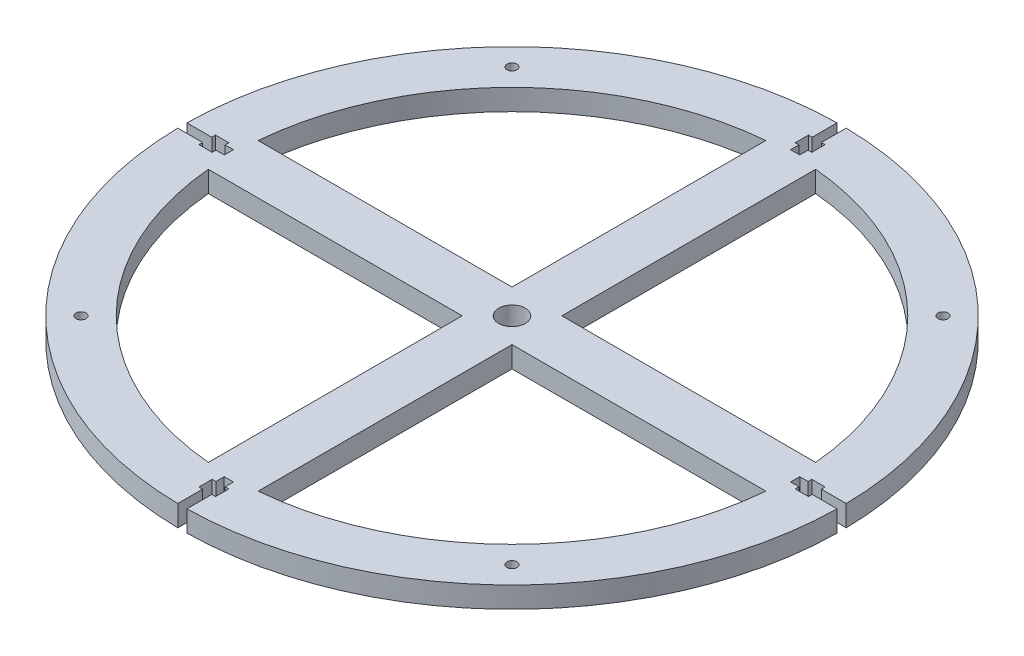
from build123d import *

# Parameters (mm, degrees)
SKETCH1_W                    = 15
SKETCH1_H                    = 15
BOSS_EXTRUDE1_DEPTH          = 3.175
SKETCH2_W                    = 2.75
SKETCH2_H                    = 2.5
SKETCH2_H_2                  = 4
SKETCH2_W_2                  = 1.125
SKETCH2_H_3                  = 7.5
CUT_EXTRUDE1_DEPTH           = 141.379634965
CIRPATTERN1_COUNT            = 4
F_3_0_3_DIAMETER_HOLE1_D     = 3
F_8_0_8_DIAMETER_HOLE1_D     = 8
F_8_0_8_DIAMETER_HOLE1_DEPTH = 6.35


with BuildPart() as part:
    # Sketch1 → Boss-Extrude1 (new, symmetric)
    with BuildSketch(Plane(origin=(0, 0, 0), x_dir=(1, 0, 0), z_dir=(0, 1, 0))):
        with BuildLine():
            Line((-83.903460262, -7.5), (-98.95418457, -7.5))
            ThreePointArc((-98.95418457, -7.5), (-70.171862751, -70.171862751), (-7.5, -98.95418457))
            Line((-7.5, -98.95418457), (-7.5, -83.903460262))
            ThreePointArc((-7.5, -83.903460262), (-59.565261034, -59.565261034), (-83.903460262, -7.5))
        make_face()
        with BuildLine():
            ThreePointArc((-98.95418457, 7.5), (-99.238, 0), (-98.95418457, -7.5))
            Line((-98.95418457, -7.5), (-83.903460262, -7.5))
            ThreePointArc((-83.903460262, -7.5), (-84.238, 0), (-83.903460262, 7.5))
            Line((-83.903460262, 7.5), (-98.95418457, 7.5))
        make_face()
        with BuildLine():
            Line((83.903460262, -7.5), (98.95418457, -7.5))
            ThreePointArc((98.95418457, -7.5), (99.167020759, -3.752684079), (99.238, 0))
            ThreePointArc((99.238, 0), (99.167020759, 3.752684079), (98.95418457, 7.5))
            Line((98.95418457, 7.5), (83.903460262, 7.5))
            ThreePointArc((83.903460262, 7.5), (84.154323506, 3.753728707), (84.238, 0))
            ThreePointArc((84.238, 0), (84.154323506, -3.753728707), (83.903460262, -7.5))
        make_face()
        with BuildLine():
            ThreePointArc((-7.5, 98.95418457), (-70.171862751, 70.171862751), (-98.95418457, 7.5))
            Line((-98.95418457, 7.5), (-83.903460262, 7.5))
            ThreePointArc((-83.903460262, 7.5), (-59.565261034, 59.565261034), (-7.5, 83.903460262))
            Line((-7.5, 83.903460262), (-7.5, 98.95418457))
        make_face()
        with BuildLine():
            Line((-7.5, -83.903460262), (-7.5, -98.95418457))
            ThreePointArc((-7.5, -98.95418457), (0, -99.238), (7.5, -98.95418457))
            Line((7.5, -98.95418457), (7.5, -83.903460262))
            ThreePointArc((7.5, -83.903460262), (0, -84.238), (-7.5, -83.903460262))
        make_face()
        with BuildLine():
            ThreePointArc((7.5, 98.95418457), (0, 99.238), (-7.5, 98.95418457))
            Line((-7.5, 98.95418457), (-7.5, 83.903460262))
            ThreePointArc((-7.5, 83.903460262), (0, 84.238), (7.5, 83.903460262))
            Line((7.5, 83.903460262), (7.5, 98.95418457))
        make_face()
        with BuildLine():
            ThreePointArc((98.95418457, 7.5), (70.171862751, 70.171862751), (7.5, 98.95418457))
            Line((7.5, 98.95418457), (7.5, 83.903460262))
            ThreePointArc((7.5, 83.903460262), (59.565261034, 59.565261034), (83.903460262, 7.5))
            Line((83.903460262, 7.5), (98.95418457, 7.5))
        make_face()
        with BuildLine():
            Line((7.5, -83.903460262), (7.5, -98.95418457))
            ThreePointArc((7.5, -98.95418457), (70.171862751, -70.171862751), (98.95418457, -7.5))
            Line((98.95418457, -7.5), (83.903460262, -7.5))
            ThreePointArc((83.903460262, -7.5), (59.565261034, -59.565261034), (7.5, -83.903460262))
        make_face()
        with BuildLine():
            Line((7.5, -7.5), (-7.5, -7.5))
            Line((-7.5, -7.5), (-7.5, -83.903460262))
            ThreePointArc((-7.5, -83.903460262), (0, -84.238), (7.5, -83.903460262))
            Line((7.5, -83.903460262), (7.5, -7.5))
        make_face()
        with BuildLine():
            ThreePointArc((-83.903460262, 7.5), (-84.238, 0), (-83.903460262, -7.5))
            Line((-83.903460262, -7.5), (-7.5, -7.5))
            Line((-7.5, -7.5), (-7.5, 7.5))
            Line((-7.5, 7.5), (-83.903460262, 7.5))
        make_face()
        with BuildLine():
            Line((-7.5, 83.903460262), (-7.5, 7.5))
            Line((-7.5, 7.5), (7.5, 7.5))
            Line((7.5, 7.5), (7.5, 83.903460262))
            ThreePointArc((7.5, 83.903460262), (0, 84.238), (-7.5, 83.903460262))
        make_face()
        with BuildLine():
            Line((7.5, 7.5), (7.5, -7.5))
            Line((7.5, -7.5), (83.903460262, -7.5))
            ThreePointArc((83.903460262, -7.5), (84.154323506, -3.753728707), (84.238, 0))
            ThreePointArc((84.238, 0), (84.154323506, 3.753728707), (83.903460262, 7.5))
            Line((83.903460262, 7.5), (7.5, 7.5))
        make_face()
        Rectangle(SKETCH1_W, SKETCH1_H)
    extrude(amount=BOSS_EXTRUDE1_DEPTH, both=True)

    # Sketch2 → Cut-Extrude1 (cut, symmetric)
    with BuildSketch(Plane(origin=(0, 0, 0), x_dir=(1, 0, 0), z_dir=(0, 1, 0))):
        with Locations((0, 86.488)):
            Rectangle(SKETCH2_W, SKETCH2_H)
        with Locations((0, 89.738)):
            Rectangle(SKETCH2_W, SKETCH2_H_2)
        with Locations((1.9375, 89.738)):
            Rectangle(SKETCH2_W_2, SKETCH2_H_2)
        with Locations((0, 95.488)):
            Rectangle(SKETCH2_W, SKETCH2_H_3)
        with Locations((-1.9375, 89.738)):
            Rectangle(SKETCH2_W_2, SKETCH2_H_2)
    cut_extrude1 = extrude(amount=CUT_EXTRUDE1_DEPTH, both=True, mode=Mode.SUBTRACT)

    # CirPattern1: Cut-Extrude1 ×4 about axis
    cirpattern1_axis = Axis((0, 0, 0), (0, 1, 0))
    for i in range(1, CIRPATTERN1_COUNT):
        add(cut_extrude1.rotate(cirpattern1_axis, i * 360 / CIRPATTERN1_COUNT), mode=Mode.SUBTRACT)

    # Ø3.0 (3) Diameter Hole1 (through all)
    with Locations(Plane(origin=(0, 3.175, 0), x_dir=(1, 0, 0), z_dir=(0, 1, 0))):
        with Locations((-64.868561892, -64.868561892), (0, 0), (-64.868561892, 64.868561892), (64.868561892, 64.868561892), (64.868561892, -64.868561892)):
            Hole(F_3_0_3_DIAMETER_HOLE1_D / 2)

    # Ø8.0 (8) Diameter Hole1
    with Locations(Plane(origin=(0, 3.175, 0), x_dir=(1, 0, 0), z_dir=(0, 1, 0))):
        with Locations((0, 0)):
            Hole(F_8_0_8_DIAMETER_HOLE1_D / 2, depth=F_8_0_8_DIAMETER_HOLE1_DEPTH)


solid = part.part
